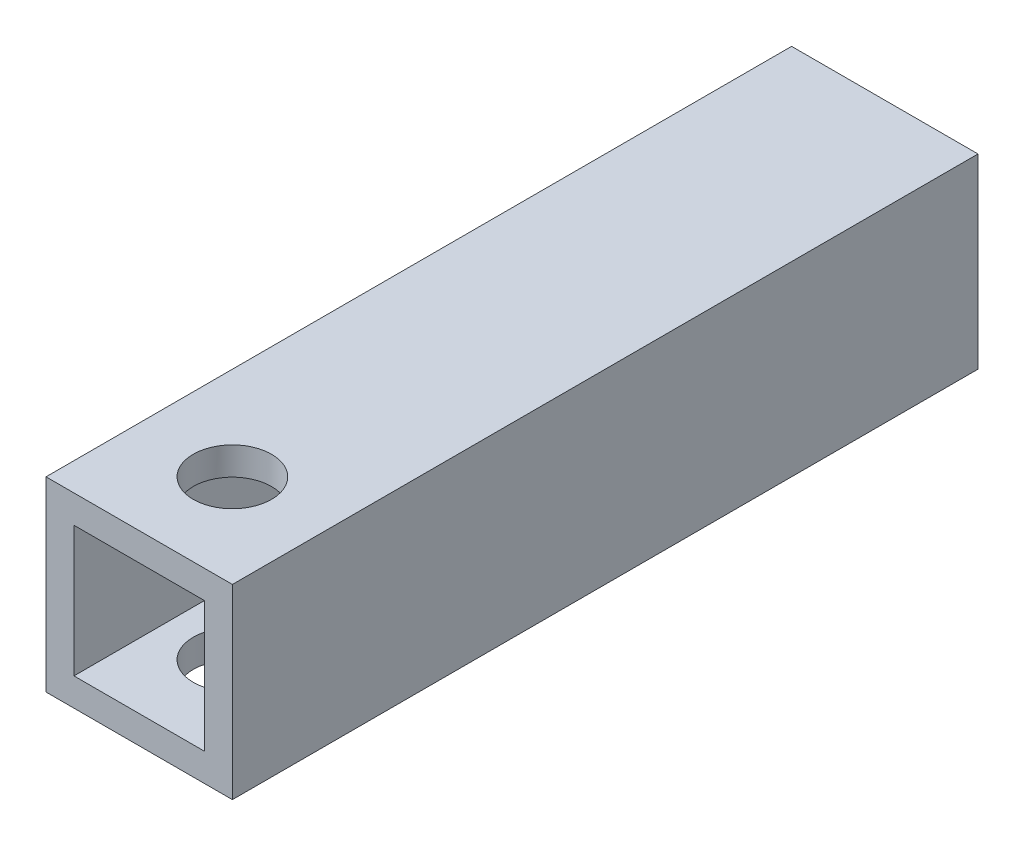
from build123d import *

# Parameters (mm, degrees)
SKETCH_1_W         = 10
SKETCH_1_H         = 10
SKETCH_1_W_2       = 7
SKETCH_1_H_2       = 7
EXTRUDE_1_DEPTH    = 40
HOLE_WIZARD_M5_1_D = 4.2


with BuildPart() as part:
    # 草圖1 → 伸長-薄件1 (new body)
    with BuildSketch(Plane.XY):
        Rectangle(SKETCH_1_W, SKETCH_1_H)
        Rectangle(SKETCH_1_W_2, SKETCH_1_H_2, mode=Mode.SUBTRACT)
    extrude(amount=EXTRUDE_1_DEPTH)

    # M5 螺紋孔1 (through all)
    with Locations(Plane(origin=(0, 5, 0), x_dir=(1, 0, 0), z_dir=(0, 1, 0))):
        with Locations((0, -35)):
            Hole(HOLE_WIZARD_M5_1_D / 2)


solid = part.part
